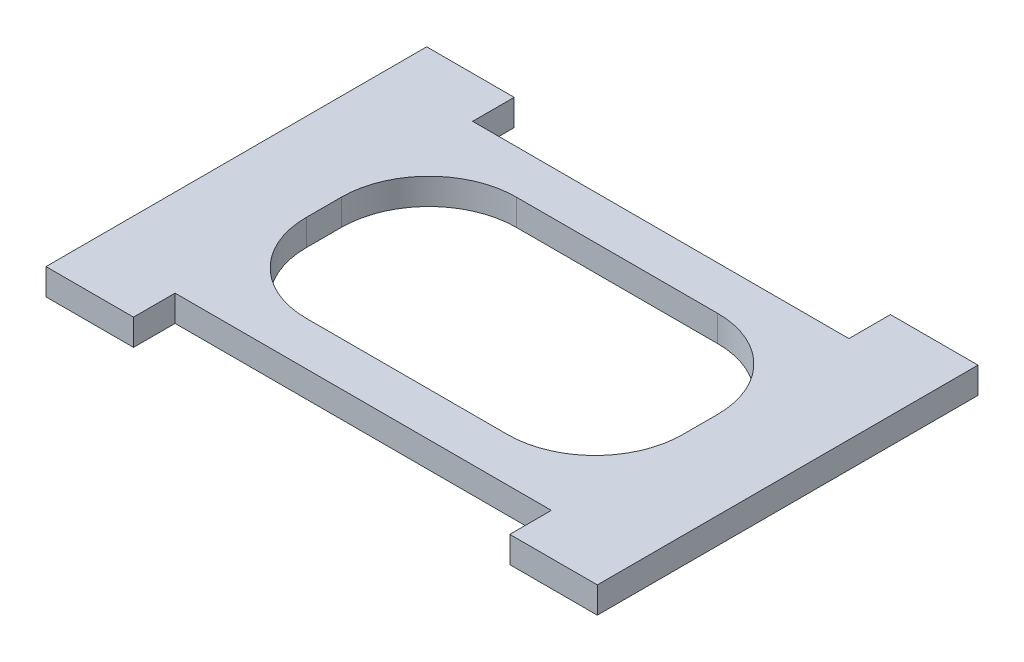
from build123d import *

# Parameters (mm, degrees)
BOSS_EXTRUDE1_DEPTH = 3
SKETCH5_W           = 43
SKETCH5_H           = 24
CUT_EXTRUDE4_DEPTH  = 3
FILLET1_R           = 10


with BuildPart() as part:
    # Sketch1 → Boss-Extrude1 (new body)
    with BuildSketch(Plane(origin=(0, 0, 0), x_dir=(1, 0, 0), z_dir=(0, 1, 0))):
        Polygon((12.75, -17), (12.75, 17), (12.75, 21.75), (2.75, 21.75), (2.75, 17), (-40.25, 17), (-40.25, 21.75), (-50.25, 21.75), (-50.25, 17), (-50.25, -17), (-50.25, -21.75), (-40.25, -21.75), (-40.25, -17), (2.75, -17), (2.75, -21.75), (12.75, -21.75), align=None)
    extrude(amount=BOSS_EXTRUDE1_DEPTH)

    # Sketch5 → Cut-Extrude4 (cut)
    with BuildSketch(Plane(origin=(0, 3, 0), x_dir=(1, 0, 0), z_dir=(0, 1, 0))):
        with Locations((-18.75, 0)):
            Rectangle(SKETCH5_W, SKETCH5_H)
    extrude(amount=-CUT_EXTRUDE4_DEPTH, mode=Mode.SUBTRACT)

    # Fillet1
    fillet1_edges = [part.edges().sort_by_distance(p)[0] for p in [
        (2.75, 1.5, 12),
        (-40.25, 1.5, 12),
        (-40.25, 1.5, -12),
        (2.75, 1.5, -12),
    ]]
    fillet(fillet1_edges, radius=FILLET1_R)


solid = part.part
